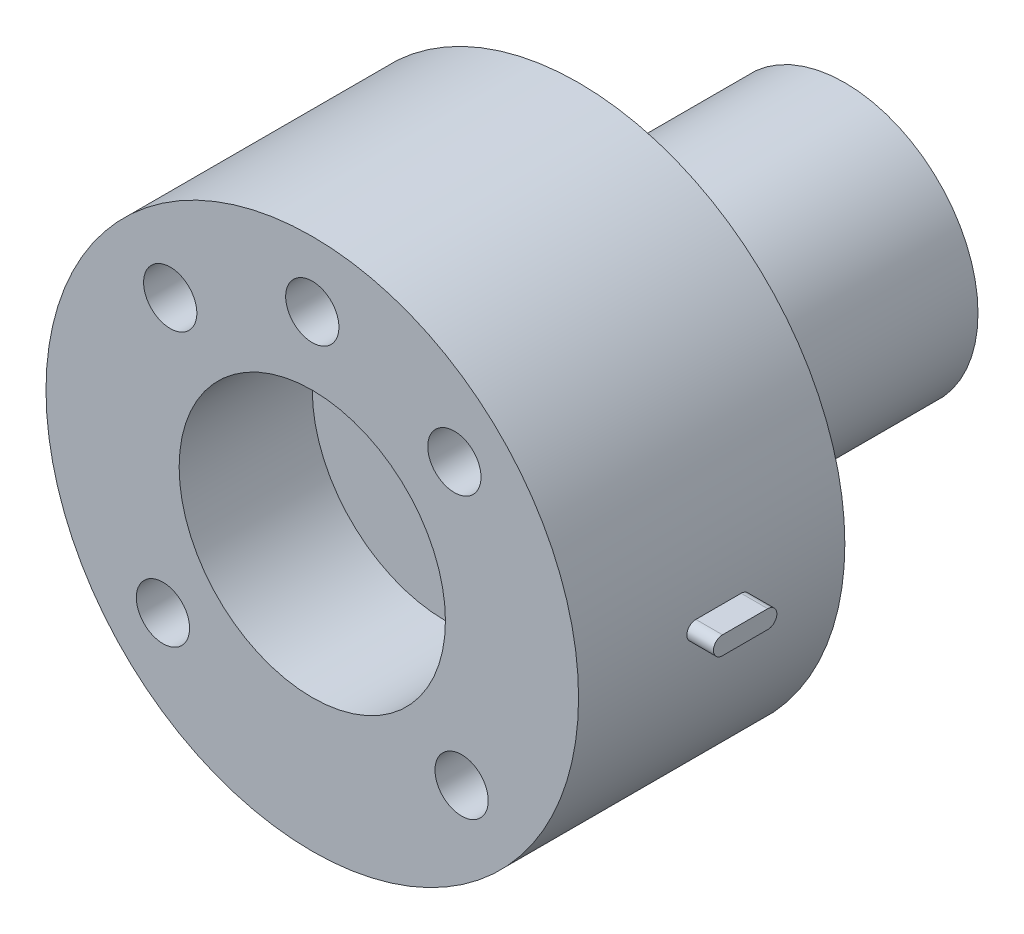
from build123d import *

# Parameters (mm, degrees)
SKETCH1_R           = 20
BOSS_EXTRUDE1_DEPTH = 20
SKETCH2_R           = 10
BOSS_EXTRUDE2_DEPTH = 20
SKETCH3_R           = 10
CUT_EXTRUDE1_DEPTH  = 10
SKETCH9_R           = 2
CUT_EXTRUDE2_DEPTH  = 5
BOSS_EXTRUDE3_DEPTH = 2


with BuildPart() as part:
    # Sketch1 → Boss-Extrude1 (new body)
    with BuildSketch(Plane.XY):
        Circle(SKETCH1_R)
    extrude(amount=BOSS_EXTRUDE1_DEPTH)

    # Sketch2 → Boss-Extrude2 (add)
    with BuildSketch(Plane(origin=(0, 0, 0), x_dir=(-1, 0, 0), z_dir=(0, 0, -1))):
        Circle(SKETCH2_R)
    extrude(amount=BOSS_EXTRUDE2_DEPTH)

    # Sketch3 → Cut-Extrude1 (cut)
    with BuildSketch(Plane.XY.offset(20)):
        with Locations(Location((0, 0, 0), (0, 0, 180))):
            Circle(SKETCH3_R)
    extrude(amount=-CUT_EXTRUDE1_DEPTH, mode=Mode.SUBTRACT)

    # Sketch9 → Cut-Extrude2 (cut)
    with BuildSketch(Plane.XY.offset(20)):
        with Locations((0, 15.091110353)):
            Circle(SKETCH9_R)
        with Locations((10.671026466, 10.671026466)):
            Circle(SKETCH9_R)
        with Locations((11.214880569, -10.097923821)):
            Circle(SKETCH9_R)
        with Locations(Location((-11.214880569, -10.097923821, 0), (0, 0, 180))):
            Circle(SKETCH9_R)
        with Locations(Location((-10.671026466, 10.671026466, 0), (0, 0, 180))):
            Circle(SKETCH9_R)
    extrude(amount=-CUT_EXTRUDE2_DEPTH, mode=Mode.SUBTRACT)


with BuildPart() as body_2:
    # Sketch10 → Boss-Extrude3 (new body)
    with BuildSketch(Plane(origin=(20, 0, 0), x_dir=(0, 0, -1), z_dir=(1, 0, 0))):
        with BuildLine():
            Line((-11.188513729, 0.679808429), (-7.789471584, 0.679808429))
            ThreePointArc((-7.789471584, 0.679808429), (-7.109663155, 0), (-7.789471584, -0.679808429))
            Line((-7.789471584, -0.679808429), (-11.188513729, -0.679808429))
            ThreePointArc((-11.188513729, -0.679808429), (-11.868322158, 0), (-11.188513729, 0.679808429))
        make_face()
    extrude(amount=BOSS_EXTRUDE3_DEPTH)


solid = Compound([part.part, body_2.part])
